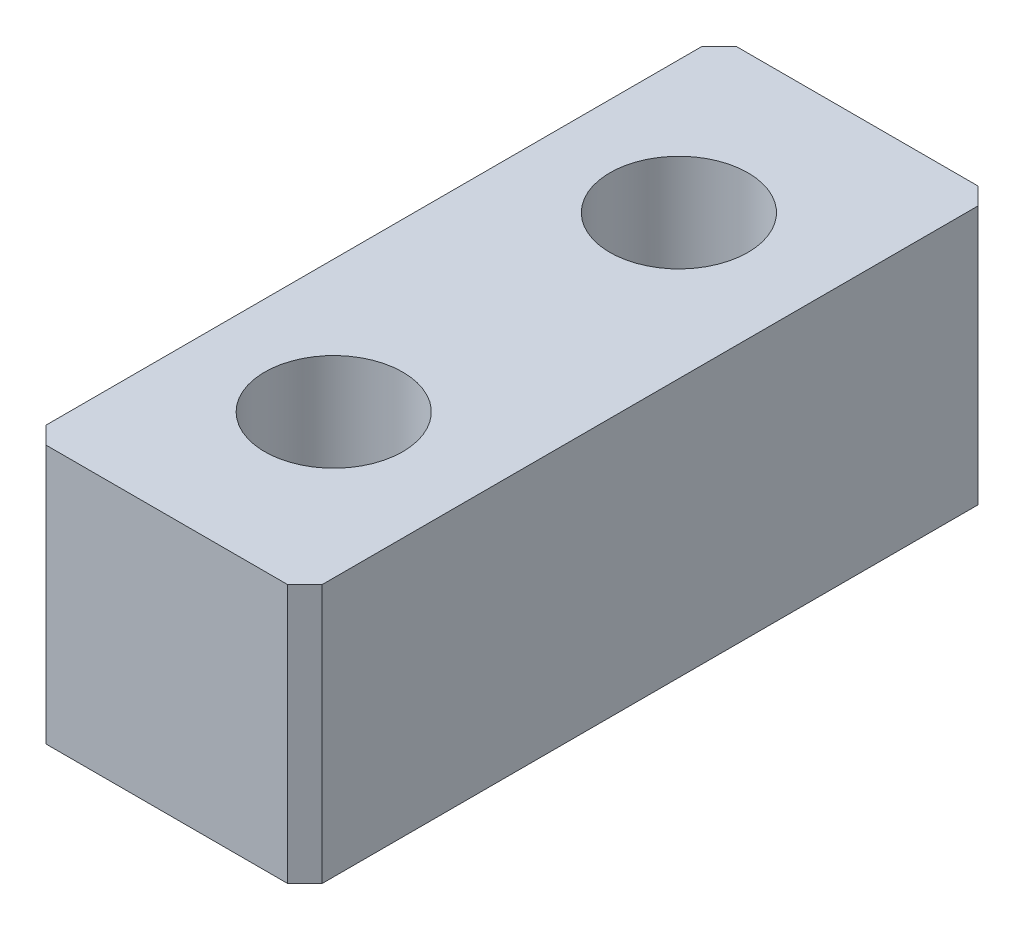
from build123d import *

# Parameters (mm, degrees)
SKETCH_1_W            = 8
SKETCH_1_H            = 7.5
EXTRUDE_1_DEPTH       = 10
CHAMFER_1_SIZE        = 0.5
HOLE_WIZARD_4_0_4_1_D = 4


with BuildPart() as part:
    # 草图1 → 凸台-拉伸1 (new, symmetric)
    with BuildSketch(Plane.XY):
        Rectangle(SKETCH_1_W, SKETCH_1_H)
    extrude(amount=EXTRUDE_1_DEPTH, both=True)

    # 倒角1
    chamfer_1_edges = [part.edges().sort_by_distance(p)[0] for p in [
        (4, 0, 10),
        (-4, 0, 10),
        (4, 0, -10),
        (-4, 0, -10),
    ]]
    chamfer(chamfer_1_edges, length=CHAMFER_1_SIZE)

    # Ø4.0 (4) 直径孔1 (through all)
    with Locations(Plane(origin=(51.8, -3.75, -33), x_dir=(-1, 0, 0), z_dir=(0, -1, 0))):
        with Locations((51.965, -38), (51.965, -28)):
            Hole(HOLE_WIZARD_4_0_4_1_D / 2)


solid = part.part
